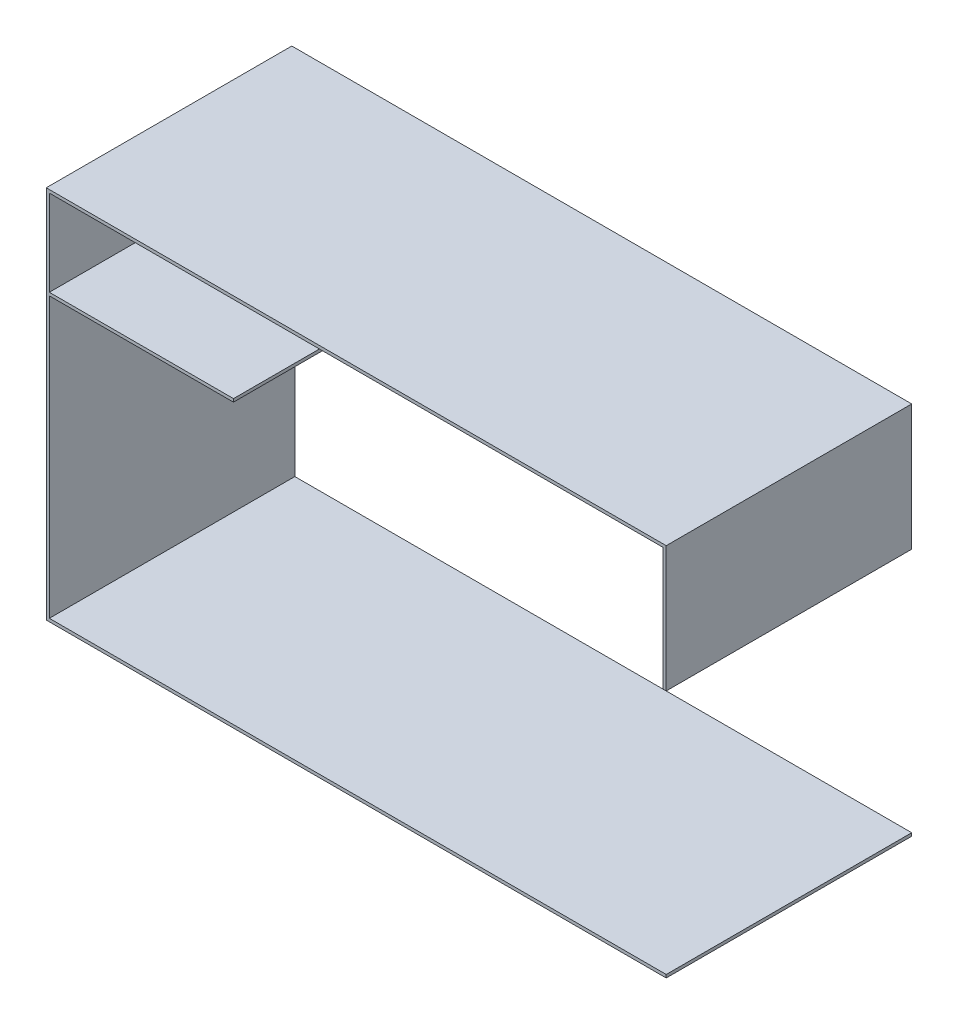
from build123d import *

# Parameters (mm, degrees)
BOSS_EXTRUDE1_DEPTH = 2000


with BuildPart() as part:
    # Sketch1 → Boss-Extrude1 (new body)
    with BuildSketch(Plane.XY):
        Polygon((-2500, 800), (-1000, 800), (-1000, 775), (-2500, 775), (-2500, -1500), (2500, -1500), (2525, -1500), (2525, -1525), (-2525, -1525), (-2525, 1525), (2525, 1525), (2525, 500), (2500, 500), (2500, 1500), (-2500, 1500), align=None)
    extrude(amount=BOSS_EXTRUDE1_DEPTH)


solid = part.part
